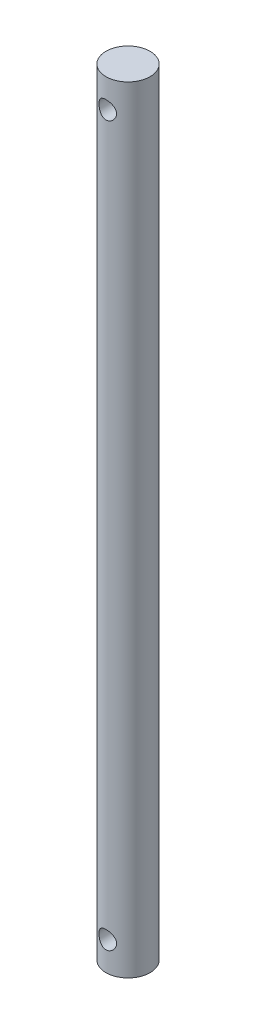
from build123d import *

# Parameters (mm, degrees)
CROQUIS1_R                 = 5
SALIENTE_EXTRUIR1_DEPTH    = 339
CROQUIS8_R                 = 6.285812581
CORTAR_EXTRUIR5_DEPTH      = 163
CORTAR_EXTRUIR6_DEPTH      = 10
CORTAR_EXTRUIR6_DEPTH_BACK = 10
CROQUIS9_R                 = 2
CORTAR_EXTRUIR7_DEPTH      = 10
CORTAR_EXTRUIR7_DEPTH_BACK = 10
CROQUIS10_R                = 2


with BuildPart() as part:
    # Croquis1 → Saliente-Extruir1 (new body)
    with BuildSketch(Plane(origin=(0, 0, 0), x_dir=(1, 0, 0), z_dir=(0, 1, 0))):
        Circle(CROQUIS1_R)
    extrude(amount=SALIENTE_EXTRUIR1_DEPTH)

    # Croquis8 → Cortar-Extruir5 (cut)
    with BuildSketch(Plane.XZ):
        Circle(CROQUIS8_R)
    extrude(amount=-CORTAR_EXTRUIR5_DEPTH, mode=Mode.SUBTRACT)

    # Croquis9 → Cortar-Extruir6 (cut, two sides: drawn at the far end of the back side and taken through both)
    with BuildSketch(Plane.XY.offset(-CORTAR_EXTRUIR6_DEPTH_BACK)):
        with Locations((0, 332.5)):
            Circle(CROQUIS9_R)
    extrude(amount=CORTAR_EXTRUIR6_DEPTH + CORTAR_EXTRUIR6_DEPTH_BACK, mode=Mode.SUBTRACT)

    # Croquis10 → Cortar-Extruir7 (cut, two sides: drawn at the far end of the back side and taken through both)
    with BuildSketch(Plane.XY.offset(-CORTAR_EXTRUIR7_DEPTH_BACK)):
        with Locations((0, 169.5)):
            Circle(CROQUIS10_R)
    extrude(amount=CORTAR_EXTRUIR7_DEPTH + CORTAR_EXTRUIR7_DEPTH_BACK, mode=Mode.SUBTRACT)


solid = part.part
